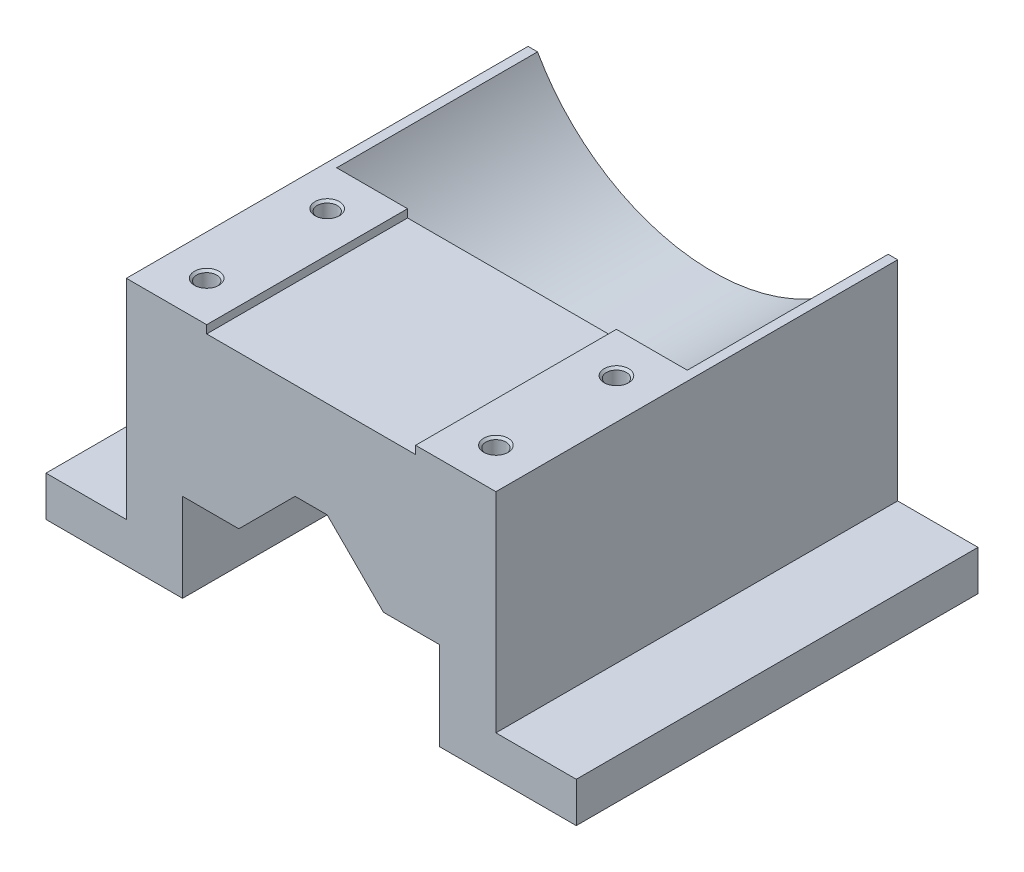
from build123d import *

# Parameters (mm, degrees)
BOSS_EXTRUDE1_DEPTH             = 50
SKETCH2_R                       = 25
CUT_EXTRUDE1_DEPTH              = 25
M3X0_5_TAPPED_HOLE1_D           = 2.5
M3X0_5_TAPPED_HOLE1_DEPTH       = 11
M3X0_5_TAPPED_HOLE1_CSINK_D     = 3.05
M3X0_5_TAPPED_HOLE1_CSINK_ANGLE = 90
M3X0_5_TAPPED_HOLE1_TIP         = 0.751075774


with BuildPart() as part:
    # Sketch1 → Boss-Extrude1 (new body)
    with BuildSketch(Plane.XY):
        Polygon((-13, 0), (13, 0), (13, 1), (23, 1), (23, -25), (33, -25), (33, -30), (16, -30), (16, -19), (9, -19), (2, -12), (-2, -12), (-9, -19), (-16, -19), (-16, -30), (-33, -30), (-33, -25), (-23, -25), (-23, 1), (-13, 1), align=None)
    extrude(amount=BOSS_EXTRUDE1_DEPTH)

    # Sketch2 → Cut-Extrude1 (cut)
    with BuildSketch(Plane(origin=(0, 0, 0), x_dir=(-1, 0, 0), z_dir=(0, 0, -1))):
        with Locations((0, 13.2)):
            Circle(SKETCH2_R)
    extrude(amount=-CUT_EXTRUDE1_DEPTH, mode=Mode.SUBTRACT)

    # M3x0.5 Tapped Hole1
    with Locations(Plane(origin=(0, 1, 0), x_dir=(1, 0, 0), z_dir=(0, 1, 0))):
        with Locations((-18, -30), (-18, -45), (18, -30), (18, -45)):
            CounterSinkHole(M3X0_5_TAPPED_HOLE1_D / 2, M3X0_5_TAPPED_HOLE1_CSINK_D / 2, depth=M3X0_5_TAPPED_HOLE1_DEPTH, counter_sink_angle=M3X0_5_TAPPED_HOLE1_CSINK_ANGLE)
            with Locations((0, 0, -(M3X0_5_TAPPED_HOLE1_DEPTH + M3X0_5_TAPPED_HOLE1_TIP / 2))):  # 118° drill point
                Cone(0, M3X0_5_TAPPED_HOLE1_D / 2, M3X0_5_TAPPED_HOLE1_TIP, mode=Mode.SUBTRACT)


solid = part.part
